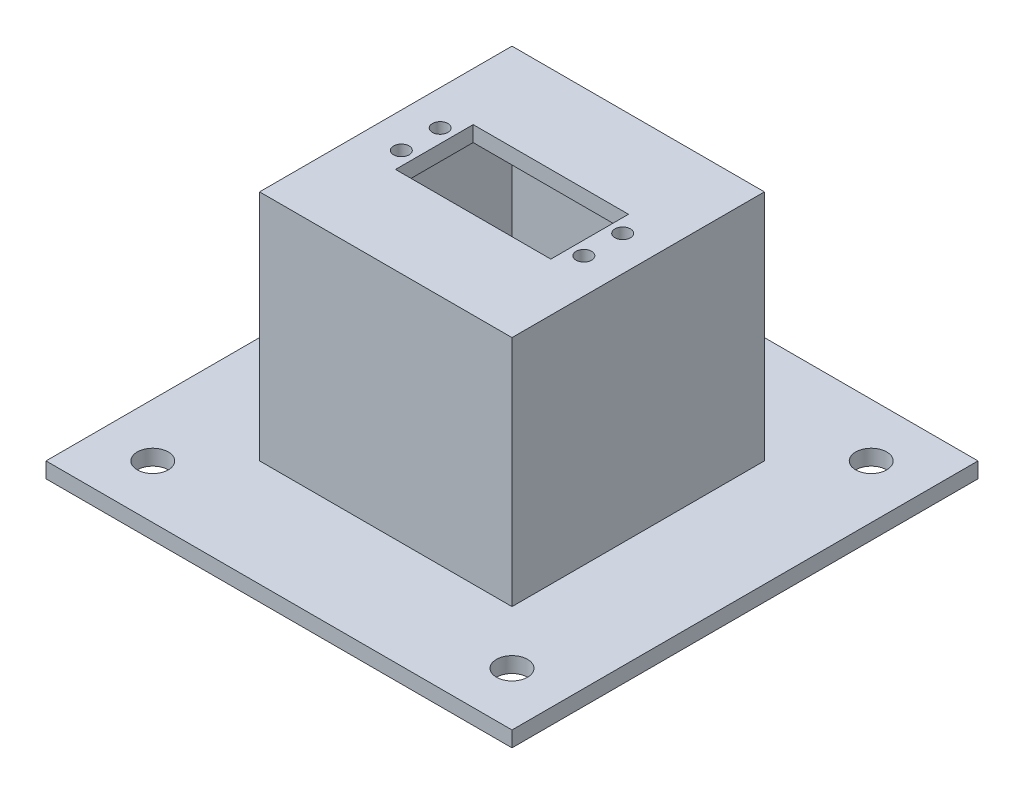
from build123d import *

# Parameters (mm, degrees)
IZIM1_W                     = 65
IZIM1_H                     = 65
Y_KSEKLIK_EKSTR_ZYON1_DEPTH = 60
BO_ALTMA1_T                 = -4
IZIM10_W                    = 120
IZIM10_H                    = 120
IZIM10_W_2                  = 65
IZIM10_H_2                  = 65
Y_KSEKLIK_EKSTR_ZYON5_DEPTH = 4
IZIM11_R                    = 4
KES_EKSTR_ZYON4_DEPTH       = 4
IZIM12_R                    = 2
IZIM12_W                    = 40
IZIM12_H                    = 20
KES_EKSTR_ZYON5_DEPTH       = 4


with BuildPart() as part:
    # Çizim1 → Yükseklik-Ekstrüzyon1 (new body)
    with BuildSketch(Plane(origin=(0, 0, 0), x_dir=(1, 0, 0), z_dir=(0, 1, 0))):
        with Locations((-32.5, 32.5)):
            Rectangle(IZIM1_W, IZIM1_H)
    extrude(amount=Y_KSEKLIK_EKSTR_ZYON1_DEPTH)

    # İç Boşaltma1
    bo_altma1_openings = [part.faces().sort_by_distance(p)[0] for p in [
        (-32.5, 0, -32.5),
    ]]
    offset(amount=BO_ALTMA1_T, openings=bo_altma1_openings, kind=Kind.INTERSECTION)

    # Çizim12 → Kes-Ekstrüzyon5 (cut)
    with BuildSketch(Plane(origin=(0, 60, 0), x_dir=(1, 0, 0), z_dir=(0, 1, 0))):
        with Locations(Location((-56, 37.5, 0), (0, 0, 270))):
            Circle(IZIM12_R)
        with Locations(Location((-56, 27.5, 0), (0, 0, 270))):
            Circle(IZIM12_R)
        with Locations(Location((-9, 27.5, 0), (0, 0, 270))):
            Circle(IZIM12_R)
        with Locations(Location((-9, 37.5, 0), (0, 0, 270))):
            Circle(IZIM12_R)
        with Locations((-32.5, 32.5)):
            Rectangle(IZIM12_W, IZIM12_H)
    extrude(amount=-KES_EKSTR_ZYON5_DEPTH, mode=Mode.SUBTRACT)


with BuildPart() as body_2:
    # Çizim10 → Yükseklik-Ekstrüzyon5 (new body)
    with BuildSketch(Plane.XZ):
        with Locations((-32.5, -32.5)):
            Rectangle(IZIM10_W, IZIM10_H)
        with Locations((-32.5, -32.5)):
            Rectangle(IZIM10_W_2, IZIM10_H_2, mode=Mode.SUBTRACT)
    extrude(amount=Y_KSEKLIK_EKSTR_ZYON5_DEPTH)

    # Çizim11 → Kes-Ekstrüzyon4 (cut)
    with BuildSketch(Plane(origin=(0, 0, 0), x_dir=(1, 0, 0), z_dir=(0, 1, 0))):
        with Locations(Location((-78.75, 78.75, 0), (0, 0, 270))):
            Circle(IZIM11_R)
        with Locations(Location((-78.75, -13.75, 0), (0, 0, 90))):
            Circle(IZIM11_R)
        with Locations(Location((13.75, -13.75, 0), (0, 0, 270))):
            Circle(IZIM11_R)
        with Locations(Location((13.75, 78.75, 0), (0, 0, 90))):
            Circle(IZIM11_R)
    extrude(amount=-KES_EKSTR_ZYON4_DEPTH, mode=Mode.SUBTRACT)


solid = Compound([part.part, body_2.part])
